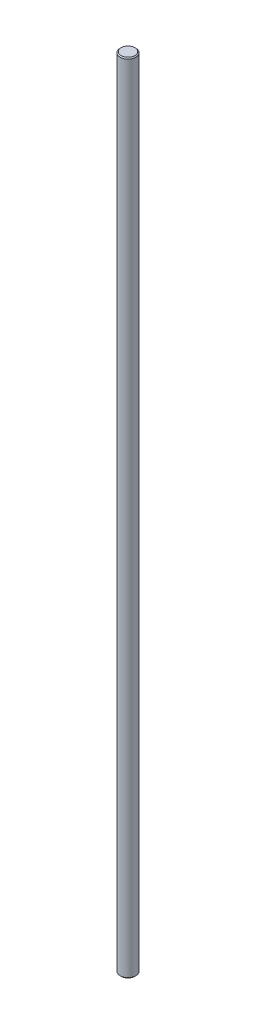
from build123d import *


with BuildPart() as part:
    # Sketch1 → Revolve1 (revolve)
    with BuildSketch(Plane.XY, mode=Mode.PRIVATE) as revolve1_sk:
        Polygon((3.5, 406), (0, 406), (0, 0), (3.5, 0), (4, 0.5), (4, 405.5), align=None)
    revolve(revolve1_sk.sketch.rotate(Axis((0, 406, 0), (0, -1, 0)), 270), axis=Axis((0, 406, 0), (0, -1, 0)))


solid = part.part
